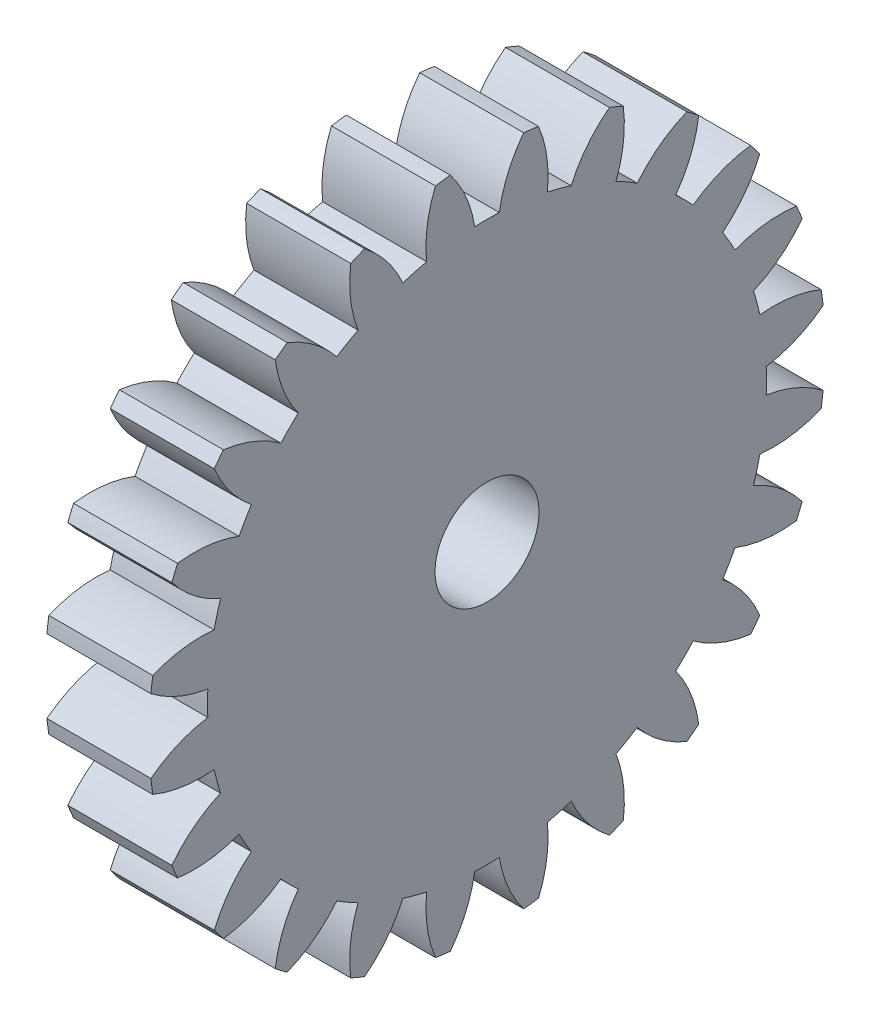
from build123d import *

# Parameters (mm, degrees)
BASPROSKE_W     = 1
BASPROSKE_H     = 3.25
TOOTHCUT_DEPTH  = 5.703721931
TEETHCUTS_COUNT = 24
TEETHCUTS_ANGLE = 345
BORSKE_R        = 0.5
BORE_DEPTH      = 50.0000508


with BuildPart() as part:
    # BasProSke → Base-Revolve (revolve)
    with BuildSketch(Plane(origin=(0, 0, 0), x_dir=(1, 0, 0), z_dir=(0, 1, 0)), mode=Mode.PRIVATE) as base_revolve_sk:
        with Locations((0.5, 1.625)):
            Rectangle(BASPROSKE_W, BASPROSKE_H)
    revolve(base_revolve_sk.sketch.rotate(Axis((-10, 0, 0), (1, 0, 0)), 180), axis=Axis((-10, 0, 0), (1, 0, 0)))

    # TooCutSke → ToothCut (cut, through all)
    with BuildSketch(Plane(origin=(0, 0, 0), x_dir=(0, 0, -1), z_dir=(1, 0, 0))):
        with BuildLine():
            ThreePointArc((0.11839249, 2.683889988), (0, 2.6865), (-0.11839249, 2.683889988))
            ThreePointArc((-0.11839249, 2.683889988), (-0.207158568, 2.985814759), (-0.371369, 3.254278757))
            ThreePointArc((-0.371369, 3.254278757), (0, 3.2754), (0.371369, 3.254278757))
            ThreePointArc((0.371369, 3.254278757), (0.207158568, 2.985814759), (0.11839249, 2.683889988))
        make_face()
    toothcut = extrude(amount=TOOTHCUT_DEPTH, mode=Mode.SUBTRACT)

    # TeethCuts: ToothCut ×24 about axis
    teethcuts_axis = Axis((-10, 0, 0), (1, 0, 0))
    for i in range(1, TEETHCUTS_COUNT):
        add(toothcut.rotate(teethcuts_axis, i * TEETHCUTS_ANGLE / (TEETHCUTS_COUNT - 1)), mode=Mode.SUBTRACT)

    # BorSke → Bore (cut, symmetric)
    with BuildSketch(Plane(origin=(0, 0, 0), x_dir=(0, 0, -1), z_dir=(1, 0, 0))):
        with Locations(Location((0, 0, 0), (0, 0, 180))):
            Circle(BORSKE_R)
    extrude(amount=BORE_DEPTH, both=True, mode=Mode.SUBTRACT)


solid = part.part
